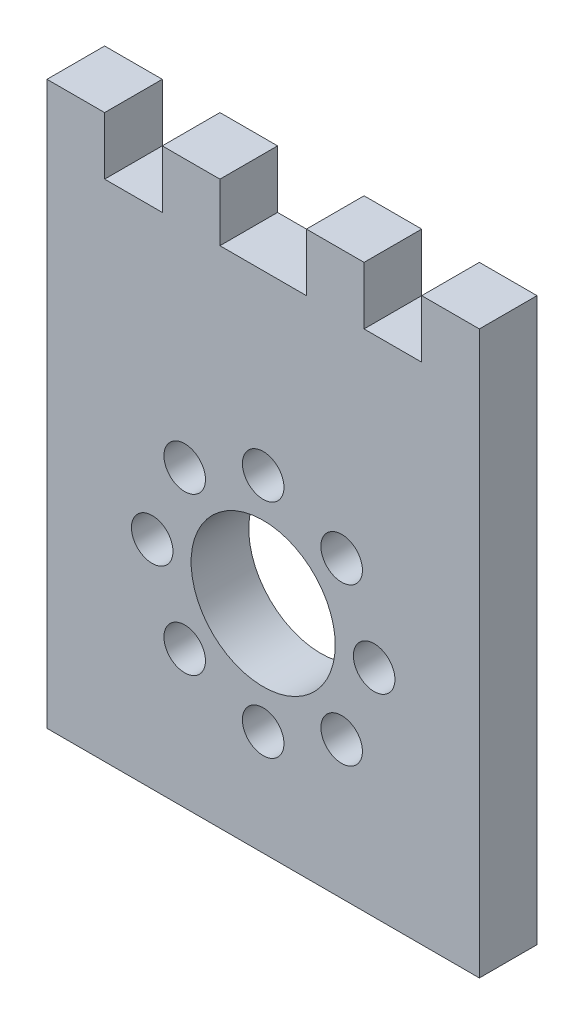
from build123d import *

# Parameters (mm, degrees)
SKETCH1_W           = 38.1
SKETCH1_H           = 50.8
BOSS_EXTRUDE1_DEPTH = 5.08
SKETCH2_R           = 6.35
SKETCH2_R_2         = 1.8288
CUT_EXTRUDE1_DEPTH  = 5.08
SKETCH3_W           = 5.08
SKETCH3_H           = 5.08
BOSS_EXTRUDE2_DEPTH = 5.08
SKETCH4_W           = 38.1
SKETCH4_H           = 5.08
CUT_EXTRUDE2_DEPTH  = 11.43


with BuildPart() as part:
    # Sketch1 → Boss-Extrude1 (new body)
    with BuildSketch(Plane.XY):
        with Locations((2.494642857, -9.638392857)):
            Rectangle(SKETCH1_W, SKETCH1_H)
    extrude(amount=BOSS_EXTRUDE1_DEPTH)

    # Sketch2 → Cut-Extrude1 (cut)
    with BuildSketch(Plane.XY.offset(5.08)):
        with Locations((2.494642857, -9.638392857)):
            Circle(SKETCH2_R)
        with Locations((12.273642857, -9.638392857)):
            Circle(SKETCH2_R_2)
        with Locations((9.40944007, -16.55319007)):
            Circle(SKETCH2_R_2)
        with Locations((2.494642857, -19.417392857)):
            Circle(SKETCH2_R_2)
        with Locations((-4.420154356, -16.55319007)):
            Circle(SKETCH2_R_2)
        with Locations((-7.284357143, -9.638392857)):
            Circle(SKETCH2_R_2)
        with Locations((-4.420154356, -2.723595644)):
            Circle(SKETCH2_R_2)
        with Locations((2.494642857, 0.140607143)):
            Circle(SKETCH2_R_2)
        with Locations((9.40944007, -2.723595644)):
            Circle(SKETCH2_R_2)
    extrude(amount=-CUT_EXTRUDE1_DEPTH, mode=Mode.SUBTRACT)

    # Sketch3 → Boss-Extrude2 (add)
    with BuildSketch(Plane.XY.offset(5.08)):
        with Locations((-14.015357143, 18.301607143)):
            Rectangle(SKETCH3_W, SKETCH3_H)
        with Locations((8.844642857, 18.301607143)):
            Rectangle(SKETCH3_W, SKETCH3_H)
        with Locations((19.004642857, 18.301607143)):
            Rectangle(SKETCH3_W, SKETCH3_H)
        with Locations((-3.855357143, 18.301607143)):
            Rectangle(SKETCH3_W, SKETCH3_H)
        with Locations((-3.855357143, -37.578392857)):
            Rectangle(SKETCH3_W, SKETCH3_H)
        with Locations((-14.015357143, -37.578392857)):
            Rectangle(SKETCH3_W, SKETCH3_H)
        with Locations((19.004642857, -37.578392857)):
            Rectangle(SKETCH3_W, SKETCH3_H)
        with Locations((8.844642857, -37.578392857)):
            Rectangle(SKETCH3_W, SKETCH3_H)
    extrude(amount=-BOSS_EXTRUDE2_DEPTH)

    # Sketch4 → Cut-Extrude2 (cut)
    with BuildSketch(Plane.XZ.offset(40.118392857)):
        with Locations((2.494642857, 2.54)):
            Rectangle(SKETCH4_W, SKETCH4_H)
    extrude(amount=-CUT_EXTRUDE2_DEPTH, mode=Mode.SUBTRACT)


solid = part.part
